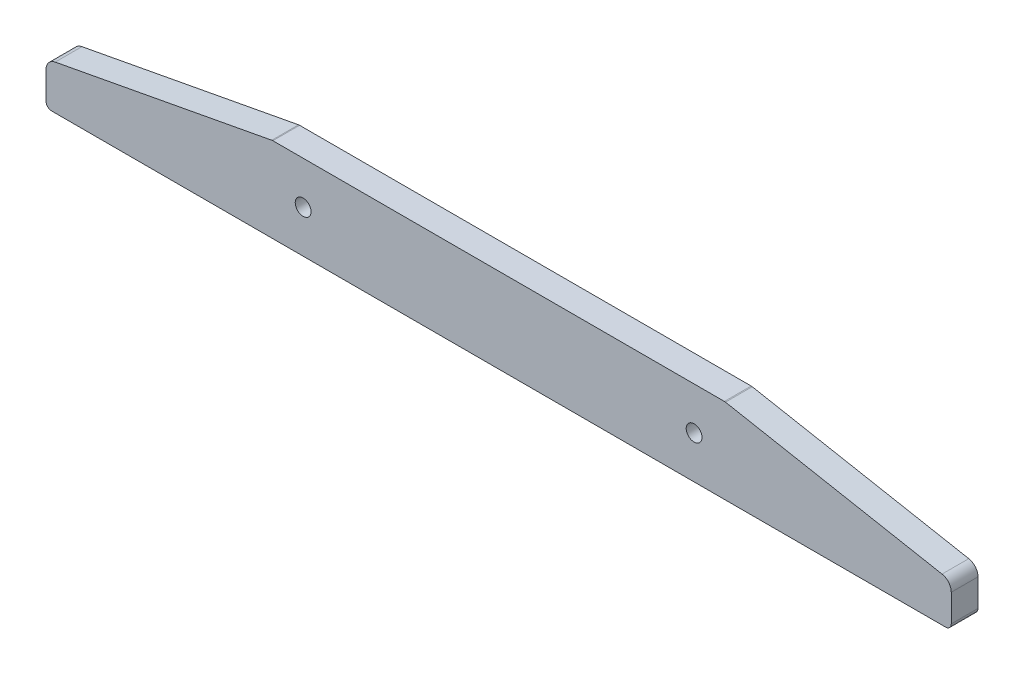
from build123d import *

# Parameters (mm, degrees)
BOSS_EXTRUDE1_DEPTH = 6
FILLET1_R           = 2.54
FILLET2_R           = 1.27
SKETCH2_R           = 1.778
CUT_EXTRUDE1_DEPTH  = 104.544495267


with BuildPart() as part:
    # Sketch1 → Boss-Extrude1 (new body)
    with BuildSketch(Plane.XY):
        Polygon((0, 0), (0, 19.05), (50.8, 19.05), (101.6, 9.525), (101.6, 0), align=None)
    boss_extrude1 = extrude(amount=BOSS_EXTRUDE1_DEPTH)

    # Mirror1: Boss-Extrude1 across plane
    add(boss_extrude1.mirror(Plane(origin=(0, 0, 6), x_dir=(0, 0, 1), z_dir=(1, 0, 0))))

    # Fillet1
    fillet1_edges = [part.edges().sort_by_distance(p)[0] for p in [
        (-101.6, 9.525, 3),
        (101.6, 9.525, 3),
    ]]
    fillet(fillet1_edges, radius=FILLET1_R)

    # Fillet2
    fillet2_edges = [part.edges().sort_by_distance(p)[0] for p in [
        (-101.6, 0, 3),
        (-50.8, 19.05, 3),
        (50.8, 19.05, 3),
        (101.6, 0, 3),
    ]]
    fillet(fillet2_edges, radius=FILLET2_R)

    # Sketch2 → Cut-Extrude1 (cut, through all)
    with BuildSketch(Plane.XY.offset(6)):
        with Locations((-43.8785, 9.525)):
            Circle(SKETCH2_R)
        with Locations((43.8785, 9.525)):
            Circle(SKETCH2_R)
    extrude(amount=-CUT_EXTRUDE1_DEPTH, mode=Mode.SUBTRACT)


solid = part.part
